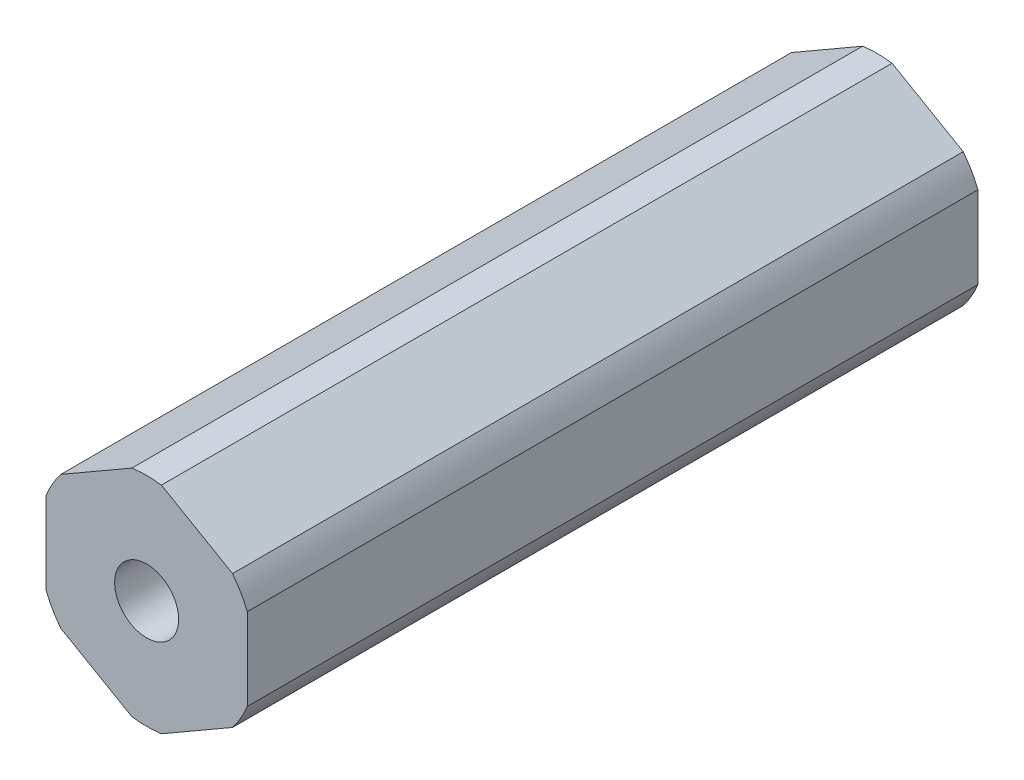
from build123d import *

# Parameters (mm, degrees)
BOSS_EXTRUDE1_DEPTH = 46.101
SKETCH2_R           = 2.0193
CUT_EXTRUDE1_DEPTH  = 48.038886732


with BuildPart() as part:
    # Sketch1 → Boss-Extrude1 (new body)
    with BuildSketch(Plane.XY):
        with BuildLine():
            Line((-0.93173274, 6.79441227), (-5.41826726, 4.204110358))
            ThreePointArc((-5.41826726, 4.204110358), (-5.939202219, 3.429), (-6.35, 2.590301913))
            Line((-6.35, 2.590301913), (-6.35, -2.590301913))
            ThreePointArc((-6.35, -2.590301913), (-5.939202219, -3.429), (-5.41826726, -4.204110358))
            Line((-5.41826726, -4.204110358), (-0.93173274, -6.79441227))
            ThreePointArc((-0.93173274, -6.79441227), (0, -6.858), (0.93173274, -6.79441227))
            Line((0.93173274, -6.79441227), (5.41826726, -4.204110358))
            ThreePointArc((5.41826726, -4.204110358), (5.939202219, -3.429), (6.35, -2.590301913))
            Line((6.35, -2.590301913), (6.35, 2.590301913))
            ThreePointArc((6.35, 2.590301913), (5.939202219, 3.429), (5.41826726, 4.204110358))
            Line((5.41826726, 4.204110358), (0.93173274, 6.79441227))
            ThreePointArc((0.93173274, 6.79441227), (0, 6.858), (-0.93173274, 6.79441227))
        make_face()
    extrude(amount=BOSS_EXTRUDE1_DEPTH)

    # Sketch2 → Cut-Extrude1 (cut, through all)
    with BuildSketch(Plane.XY.offset(46.101)):
        Circle(SKETCH2_R)
    extrude(amount=-CUT_EXTRUDE1_DEPTH, mode=Mode.SUBTRACT)


solid = part.part
